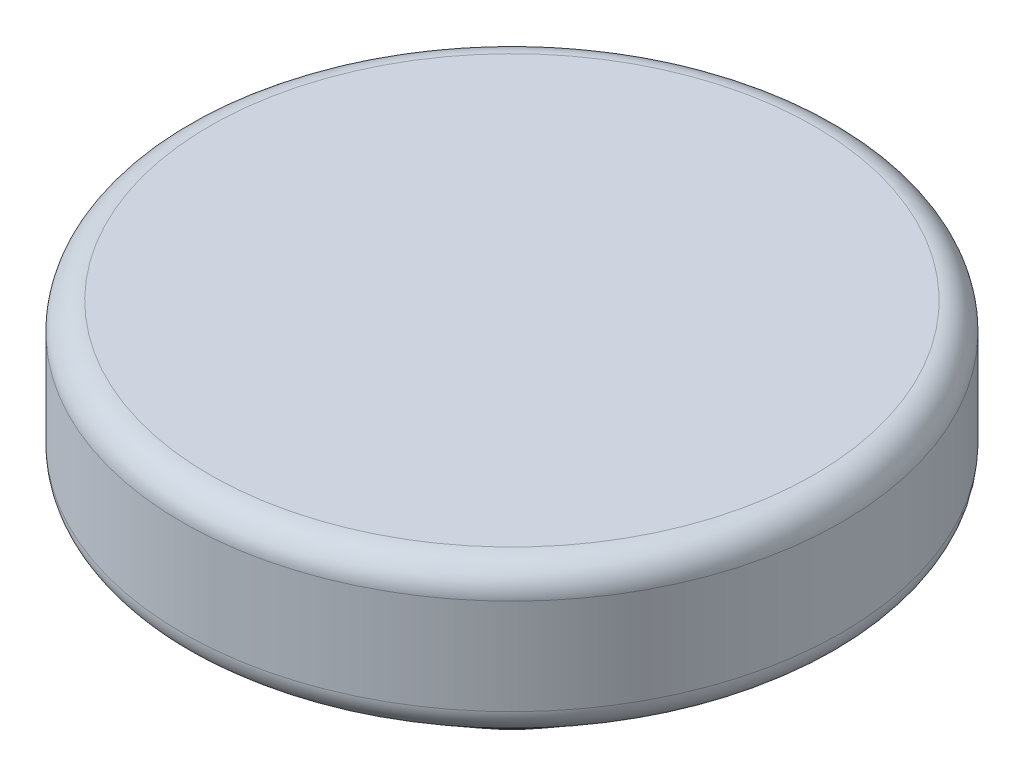
from build123d import *

# Parameters (mm, degrees)
FILLET2_R = 5
FILLET3_R = 5
FILLET4_R = 6


with BuildPart() as part:
    # Sketch1 → Revolve3 (revolve)
    with BuildSketch(Plane.XY, mode=Mode.PRIVATE) as revolve3_sk:
        Polygon((0, -44.99102057), (25, -44.99102057), (60, -19.99102057), (60, 5.00897943), (0, 5.00897943), align=None)
    revolve(revolve3_sk.sketch.rotate(Axis((0, 5.00897943, 0), (0, -1, 0)), 180), axis=Axis((0, 5.00897943, 0), (0, -1, 0)))

    # Fillet2
    fillet2_edges = [part.edges().sort_by_distance(p)[0] for p in [
        (60, 5.00897943, 0),
    ]]
    fillet(fillet2_edges, radius=FILLET2_R)

    # Fillet3
    fillet3_edges = [part.edges().sort_by_distance(p)[0] for p in [
        (60, -19.99102057, 0),
    ]]
    fillet(fillet3_edges, radius=FILLET3_R)

    # Fillet4
    fillet4_edges = [part.edges().sort_by_distance(p)[0] for p in [
        (25, -44.99102057, 0),
    ]]
    fillet(fillet4_edges, radius=FILLET4_R)


solid = part.part
